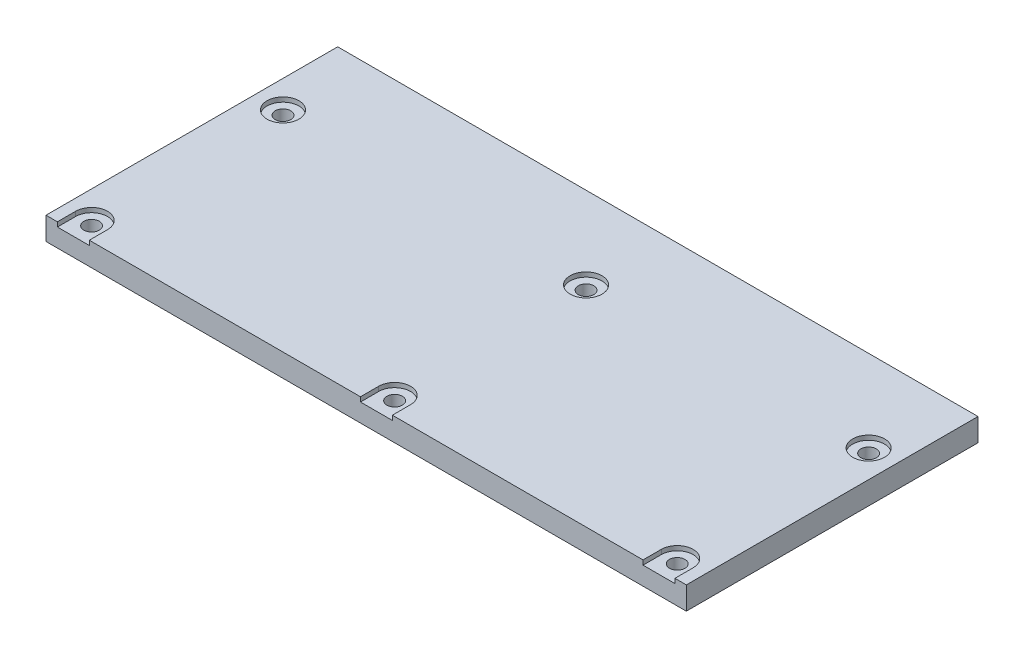
from build123d import *

# Parameters (mm, degrees)
SKETCH_1_W                   = 140.5
SKETCH_1_H                   = 64
EXTRUDE_1_DEPTH              = 5
HOLE_WIZARD_M3_1_D           = 3.4
HOLE_WIZARD_M3_1_CBORE_D     = 7
HOLE_WIZARD_M3_1_CBORE_DEPTH = 1
SKETCH_4_W                   = 7
SKETCH_4_H                   = 4
CUT_EXTRUDE_1_DEPTH          = 1


with BuildPart() as part:
    # 草图1 → 凸台-拉伸1 (new body)
    with BuildSketch(Plane(origin=(0, 0, 0), x_dir=(1, 0, 0), z_dir=(0, 1, 0))):
        with Locations((-16.998618785, 11.872928177)):
            Rectangle(SKETCH_1_W, SKETCH_1_H)
    extrude(amount=EXTRUDE_1_DEPTH)

    # M3 六角头机械螺钉的柱形沉头孔1 (through all)
    with Locations(Plane(origin=(0, 5, 0), x_dir=(1, 0, 0), z_dir=(0, 1, 0))):
        with Locations((-81.248618785, 25.872928177), (-81.248618785, -16.127071823), (-14.748618785, 25.872928177), (-14.748618785, -16.127071823), (47.251381215, 25.872928177), (47.251381215, -16.127071823)):
            CounterBoreHole(HOLE_WIZARD_M3_1_D / 2, HOLE_WIZARD_M3_1_CBORE_D / 2, HOLE_WIZARD_M3_1_CBORE_DEPTH)

    # 草图4 → 切除-拉伸1 (cut)
    with BuildSketch(Plane(origin=(0, 5, 0), x_dir=(1, 0, 0), z_dir=(0, 1, 0))):
        with Locations((-81.248618785, -18.127071823)):
            Rectangle(SKETCH_4_W, SKETCH_4_H)
        with Locations((-14.748618785, -18.127071823)):
            Rectangle(SKETCH_4_W, SKETCH_4_H)
        with Locations((47.251381215, -18.127071823)):
            Rectangle(SKETCH_4_W, SKETCH_4_H)
    extrude(amount=-CUT_EXTRUDE_1_DEPTH, mode=Mode.SUBTRACT)


solid = part.part
